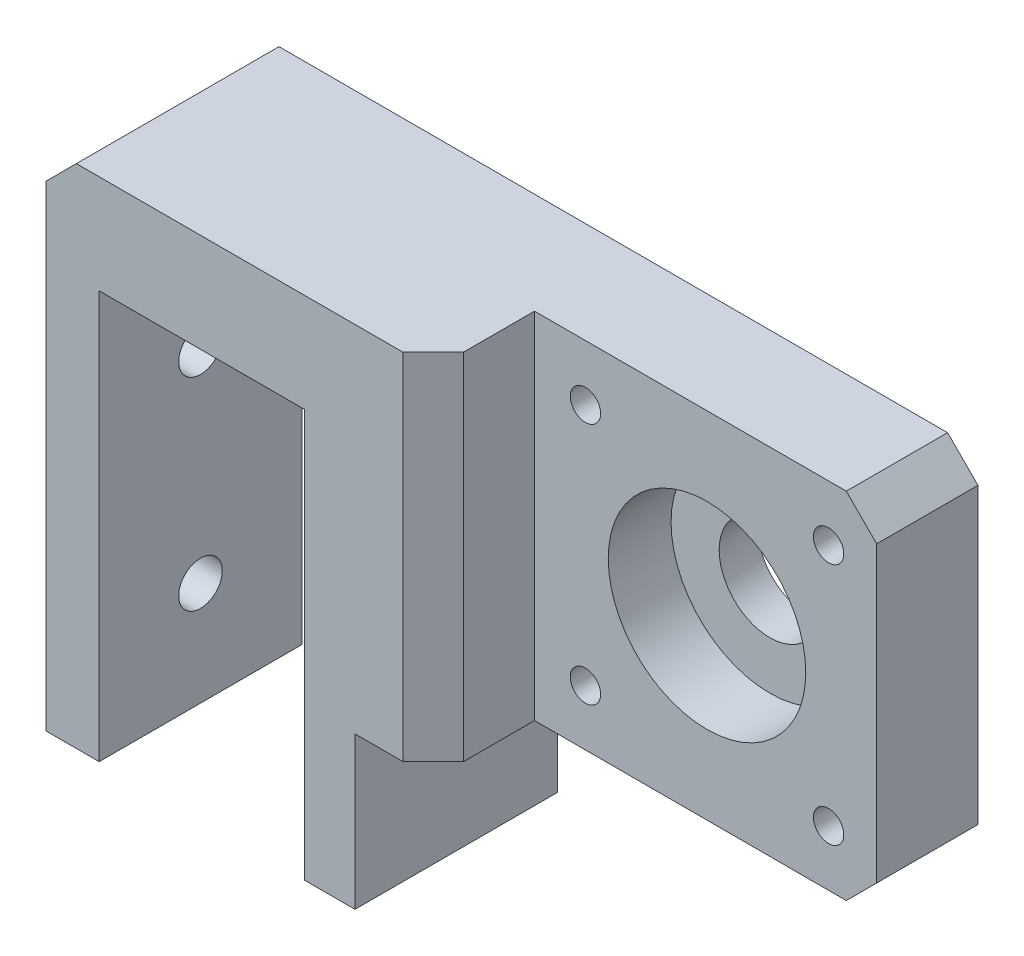
from build123d import *

# Parameters (mm, degrees)
SKETCH_5_R          = 5
SKETCH_5_R_2        = 1.5
EXTRUDE_1_DEPTH     = 20
SKETCH_6_R          = 2.15
CUT_EXTRUDE_3_DEPTH = 20
CUT_EXTRUDE_START   = -20
SKETCH_7_R          = 2.15
CUT_EXTRUDE_4_DEPTH = 20
SKETCH_8_W          = 33.77726644
SKETCH_8_H          = 35
CUT_EXTRUDE_5_DEPTH = 10
SKETCH_9_R          = 9.75
CUT_EXTRUDE_6_DEPTH = 6.2
CHAMFER_1_SIZE      = 3
SKETCH_12_W         = 110.408141216
SKETCH_12_H         = 73.303439967
CUT_EXTRUDE_8_DEPTH = 20
SKETCH_13_W         = 20.5
SKETCH_13_H         = 20
EXTRUDE_2_DEPTH     = 0.25
SKETCH_14_W         = 20
SKETCH_14_H         = 40.25
SKETCH_14_R         = 2.15
EXTRUDE_3_DEPTH     = 0.25


with BuildPart() as part:
    # 草图5 → 凸台-拉伸1 (new body)
    with BuildSketch(Plane.XY):
        Polygon((0, 0), (0, 50), (72, 50), (72, 15), (30.5, 15), (30.5, 0), (25.5, 0), (25.5, 40.5), (5, 40.5), (5, 0), align=None)
        with Locations((55.25, 32.5)):
            Circle(SKETCH_5_R, mode=Mode.SUBTRACT)
        with Locations((43.25, 44.5)):
            Circle(SKETCH_5_R_2, mode=Mode.SUBTRACT)
        with Locations((67.25, 44.5)):
            Circle(SKETCH_5_R_2, mode=Mode.SUBTRACT)
        with Locations((43.25, 20.5)):
            Circle(SKETCH_5_R_2, mode=Mode.SUBTRACT)
        with Locations((67.25, 20.5)):
            Circle(SKETCH_5_R_2, mode=Mode.SUBTRACT)
    extrude(amount=EXTRUDE_1_DEPTH)

    # 草图6 → 切除-拉伸3 (cut)
    with BuildSketch(Plane.ZY):
        with Locations((10, 10.25)):
            Circle(SKETCH_6_R)
        with Locations((10, 30.25)):
            Circle(SKETCH_6_R)
    extrude(amount=-CUT_EXTRUDE_3_DEPTH, mode=Mode.SUBTRACT)

    # 草图7 → 切除-拉伸4 (cut)
    with BuildSketch(Plane(origin=(30.5, 0, 0), x_dir=(0, 0, -1), z_dir=(1, 0, 0)).offset(CUT_EXTRUDE_START)):
        with Locations(Location((-10, 10.25, 0), (0, 0, 180))):
            Circle(SKETCH_7_R)
    extrude(amount=CUT_EXTRUDE_4_DEPTH, mode=Mode.SUBTRACT)

    # 草图8 → 切除-拉伸5 (cut)
    with BuildSketch(Plane(origin=(0, 0, 0), x_dir=(-1, 0, 0), z_dir=(0, 0, -1))):
        with Locations((-55.11136678, 32.5)):
            Rectangle(SKETCH_8_W, SKETCH_8_H)
    extrude(amount=-CUT_EXTRUDE_5_DEPTH, mode=Mode.SUBTRACT)

    # 草图9 → 切除-拉伸6 (cut)
    with BuildSketch(Plane(origin=(0, 0, 10), x_dir=(-1, 0, 0), z_dir=(0, 0, -1))):
        with Locations((-55.25, 32.5)):
            Circle(SKETCH_9_R)
    extrude(amount=-CUT_EXTRUDE_6_DEPTH, mode=Mode.SUBTRACT)

    # 倒角1
    chamfer_1_edges = [part.edges().sort_by_distance(p)[0] for p in [
        (0, 50, 10),
        (72, 50, 15),
        (72, 15, 15),
        (38.22273356, 32.5, 0),
    ]]
    chamfer(chamfer_1_edges, length=CHAMFER_1_SIZE)


with BuildPart() as body_2:
    # 镜向1: mirrored copy
    add(part.part.mirror(Plane(origin=(0, 0, 20), x_dir=(1, 0, 0), z_dir=(0, 0, -1))))

    # 草图13 → 凸台-拉伸2 (add)
    with BuildSketch(Plane.XZ.offset(-40.5)):
        with Locations((15.25, 30)):
            Rectangle(SKETCH_13_W, SKETCH_13_H)
    extrude(amount=EXTRUDE_2_DEPTH)

    # 草图14 → 凸台-拉伸3 (add)
    with BuildSketch(Plane(origin=(5, 0, 0), x_dir=(0, 0, -1), z_dir=(1, 0, 0))):
        with Locations((-30, 20.125)):
            Rectangle(SKETCH_14_W, SKETCH_14_H)
        with Locations((-30, 10.25)):
            Circle(SKETCH_14_R, mode=Mode.SUBTRACT)
        with Locations((-30, 30.25)):
            Circle(SKETCH_14_R, mode=Mode.SUBTRACT)
    extrude(amount=EXTRUDE_3_DEPTH)


with BuildPart() as part_1:
    add(part.part)

    # 草图12 → 切除-拉伸8 (cut)
    with BuildSketch(Plane(origin=(0, 0, 0), x_dir=(-1, 0, 0), z_dir=(0, 0, -1))):
        with Locations((-31.097159048, 24.893638624)):
            Rectangle(SKETCH_12_W, SKETCH_12_H)
    extrude(amount=-CUT_EXTRUDE_8_DEPTH, mode=Mode.SUBTRACT)


solid = body_2.part
